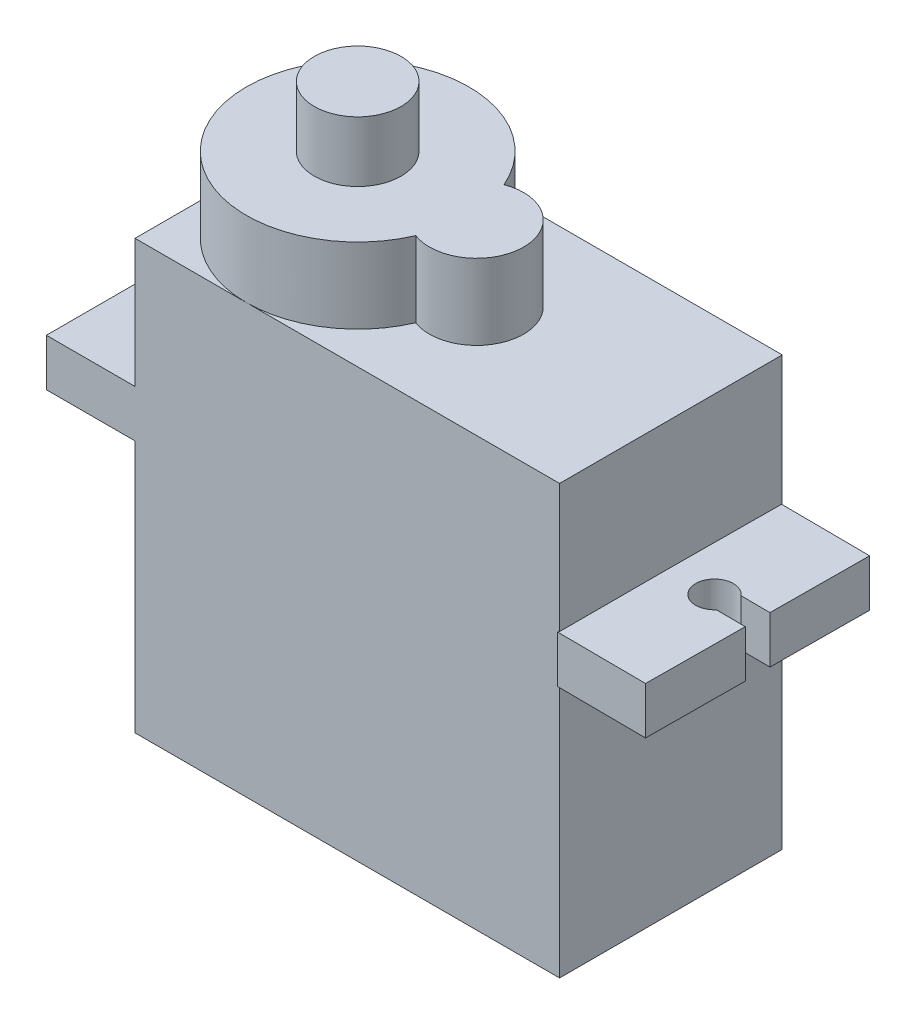
from build123d import *

# Parameters (mm, degrees)
CROQUIS1_W              = 22.5
CROQUIS1_H              = 11.8
SALIENTE_EXTRUIR1_DEPTH = 22.7
CROQUIS2_R              = 2.3
SALIENTE_EXTRUIR2_DEPTH = 4
CROQUIS3_R              = 2.3
SALIENTE_EXTRUIR3_DEPTH = 7.2
SALIENTE_EXTRUIR4_START = -6.8
SALIENTE_EXTRUIR4_DEPTH = 2.5


with BuildPart() as part:
    # Croquis1 → Saliente-Extruir1 (new body)
    with BuildSketch(Plane(origin=(0, 0, 0), x_dir=(1, 0, 0), z_dir=(0, 1, 0))):
        Rectangle(CROQUIS1_W, CROQUIS1_H)
    extrude(amount=SALIENTE_EXTRUIR1_DEPTH)

    # Croquis2 → Saliente-Extruir2 (add)
    with BuildSketch(Plane(origin=(0, 22.7, 0), x_dir=(1, 0, 0), z_dir=(0, 1, 0))):
        with BuildLine():
            ThreePointArc((0.066666667, 2.338743727), (-6.544082671, 5.777903303), (-11.25, -7.9e-08))
            ThreePointArc((-11.25, -7.9e-08), (-6.544082594, -5.777903319), (0.066666667, -2.338743727))
            ThreePointArc((0.066666667, -2.338743727), (3.45, 0), (0.066666667, 2.338743727))
        make_face()
        with Locations((-5.35, 0)):
            Circle(CROQUIS2_R, mode=Mode.SUBTRACT)
    extrude(amount=SALIENTE_EXTRUIR2_DEPTH)

    # Croquis3 → Saliente-Extruir3 (add)
    with BuildSketch(Plane(origin=(0, 22.7, 0), x_dir=(1, 0, 0), z_dir=(0, 1, 0))):
        with Locations((-5.35, 0)):
            Circle(CROQUIS3_R)
    extrude(amount=SALIENTE_EXTRUIR3_DEPTH)

    # Croquis2<3> → Saliente-Extruir4 (add)
    with BuildSketch(Plane(origin=(0, 22.7, 0), x_dir=(1, 0, 0), z_dir=(0, 1, 0)).offset(SALIENTE_EXTRUIR4_START)):
        with BuildLine():
            Line((-11.25, 5.9), (-11.25, -5.9))
            Line((-11.25, -5.9), (-15.95, -5.9))
            Line((-15.95, -5.9), (-15.95, -0.65))
            Line((-15.95, -0.65), (-14.409934208, -0.65))
            ThreePointArc((-14.409934208, -0.65), (-12.65, 0), (-14.409934208, 0.65))
            Line((-14.409934208, 0.65), (-15.95, 0.65))
            Line((-15.95, 0.65), (-15.95, 5.9))
            Line((-15.95, 5.9), (-11.25, 5.9))
        make_face()
        with BuildLine():
            Line((15.988536906, 5.794755181), (11.288638975, 5.825730005))
            Line((11.288638975, 5.825730005), (11.210872396, -5.974013736))
            Line((11.210872396, -5.974013736), (15.910770327, -6.00498856))
            Line((15.910770327, -6.00498856), (15.945369864, -0.755102574))
            Line((15.945369864, -0.755102574), (14.405337517, -0.744952943))
            ThreePointArc((14.405337517, -0.744952943), (12.649725282, -0.083368409), (14.413905022, 0.555018825))
            Line((14.413905022, 0.555018825), (15.953937369, 0.544869194))
            Line((15.953937369, 0.544869194), (15.988536906, 5.794755181))
        make_face()
    extrude(amount=-SALIENTE_EXTRUIR4_DEPTH)


solid = part.part
